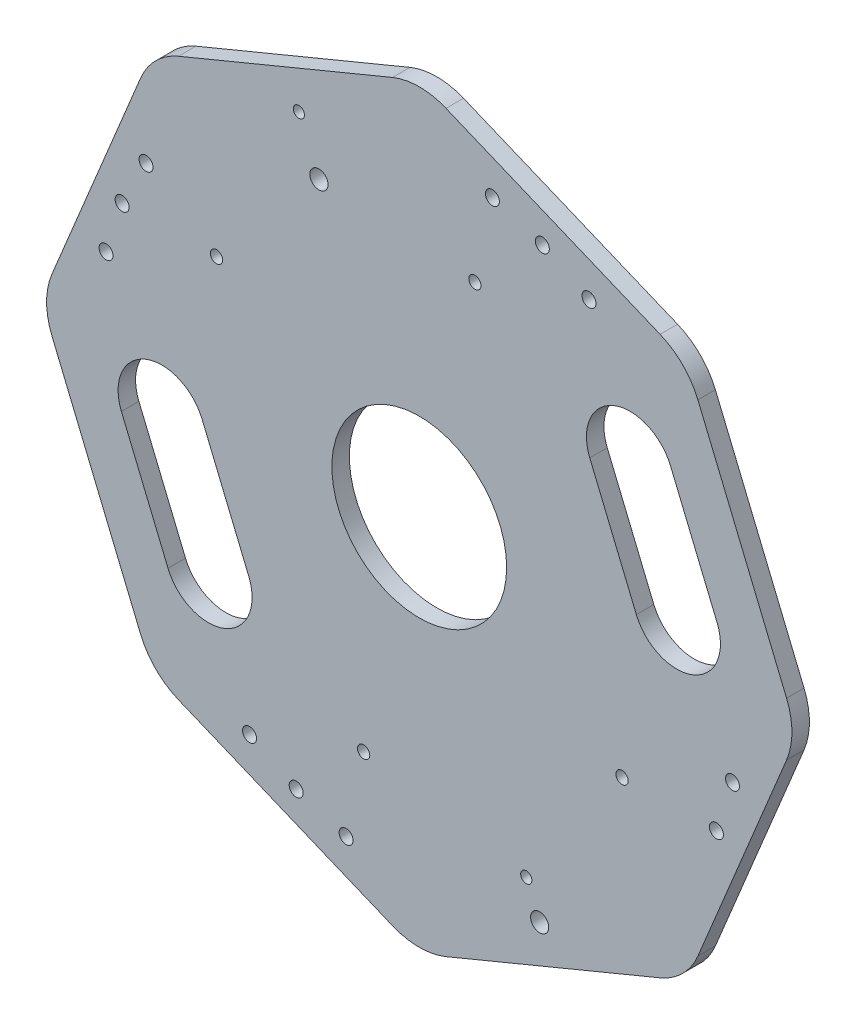
from build123d import *

# Parameters (mm, degrees)
SKETCH_1_R      = 2
SKETCH_1_R_2    = 1.75
SKETCH_1_R_3    = 25
SKETCH_1_R_4    = 1.6
SKETCH_1_R_5    = 2.6
EXTRUDE_1_DEPTH = 5
FILLET_1_R      = 20


with BuildPart() as part:
    # 草图1 → 凸台-拉伸1 (new body)
    with BuildSketch(Plane.XY):
        Polygon((0, 108.239220029), (-76.536686473, 76.536686473), (-108.239220029, 0), (-76.536686473, -76.536686473), (0, -108.239220029), (76.536686473, -76.536686473), (108.239220029, 0), (76.536686473, 76.536686473), align=None)
        with Locations((-35.206875778, -84.996916991)):
            Circle(SKETCH_1_R, mode=Mode.SUBTRACT)
        with Locations((84.996916991, -35.206875778)):
            Circle(SKETCH_1_R, mode=Mode.SUBTRACT)
        with Locations((35.206875778, 84.996916991)):
            Circle(SKETCH_1_R, mode=Mode.SUBTRACT)
        with Locations((-84.996916991, 35.206875778)):
            Circle(SKETCH_1_R, mode=Mode.SUBTRACT)
        with Locations((-58.002770081, 35.506036994)):
            Circle(SKETCH_1_R_2, mode=Mode.SUBTRACT)
        with Locations((-15.90759252, -66.120711583)):
            Circle(SKETCH_1_R_2, mode=Mode.SUBTRACT)
        with Locations((58.002770081, -35.506036994)):
            Circle(SKETCH_1_R_2, mode=Mode.SUBTRACT)
        with Locations((15.90759252, 66.120711583)):
            Circle(SKETCH_1_R_2, mode=Mode.SUBTRACT)
        with Locations((89.588318422, -20.926853617)):
            Circle(SKETCH_1_R, mode=Mode.SUBTRACT)
        with Locations((-20.926853617, -89.588318422)):
            Circle(SKETCH_1_R, mode=Mode.SUBTRACT)
        with Locations((-89.588318422, 20.926853617)):
            Circle(SKETCH_1_R, mode=Mode.SUBTRACT)
        with Locations((20.926853617, 89.588318422)):
            Circle(SKETCH_1_R, mode=Mode.SUBTRACT)
        with Locations((-48.55098737, -78.146027573)):
            Circle(SKETCH_1_R, mode=Mode.SUBTRACT)
        with Locations((-78.146027573, 48.55098737)):
            Circle(SKETCH_1_R, mode=Mode.SUBTRACT)
        with Locations((48.55098737, 78.146027573)):
            Circle(SKETCH_1_R, mode=Mode.SUBTRACT)
        Circle(SKETCH_1_R_3, mode=Mode.SUBTRACT)
        with Locations((-34.441508913, 83.149157926)):
            Circle(SKETCH_1_R_4, mode=Mode.SUBTRACT)
        with Locations((-28.701257427, 69.290964938)):
            Circle(SKETCH_1_R_5, mode=Mode.SUBTRACT)
        with Locations((30.614674589, -73.910362601)):
            Circle(SKETCH_1_R_4, mode=Mode.SUBTRACT)
        with Locations((34.441508913, -83.149157926)):
            Circle(SKETCH_1_R_5, mode=Mode.SUBTRACT)
        with BuildLine():
            Line((-62.097714236, -6.870411885), (-48.767829666, -39.051599999))
            ThreePointArc((-48.767829666, -39.051599999), (-55.532780918, -55.38363706), (-71.864817978, -48.618685808))
            Line((-71.864817978, -48.618685808), (-85.194702548, -16.437497694))
            ThreePointArc((-85.194702548, -16.437497694), (-78.429751297, -0.105460633), (-62.097714236, -6.870411885))
        make_face(mode=Mode.SUBTRACT)
        with BuildLine():
            Line((48.767829666, 39.051599999), (62.097714236, 6.870411885))
            ThreePointArc((62.097714236, 6.870411885), (78.429751297, 0.105460633), (85.194702548, 16.437497694))
            Line((85.194702548, 16.437497694), (71.864817978, 48.618685808))
            ThreePointArc((71.864817978, 48.618685808), (55.532780918, 55.38363706), (48.767829666, 39.051599999))
        make_face(mode=Mode.SUBTRACT)
    extrude(amount=EXTRUDE_1_DEPTH)

    # 圆角1
    fillet_1_edges = [part.edges().sort_by_distance(p)[0] for p in [
        (76.536686473, 76.536686473, 2.5),
        (108.239220029, 0, 2.5),
        (76.536686473, -76.536686473, 2.5),
        (0, -108.239220029, 2.5),
        (-76.536686473, -76.536686473, 2.5),
        (-108.239220029, 0, 2.5),
        (-76.536686473, 76.536686473, 2.5),
        (0, 108.239220029, 2.5),
    ]]
    fillet(fillet_1_edges, radius=FILLET_1_R)


solid = part.part
